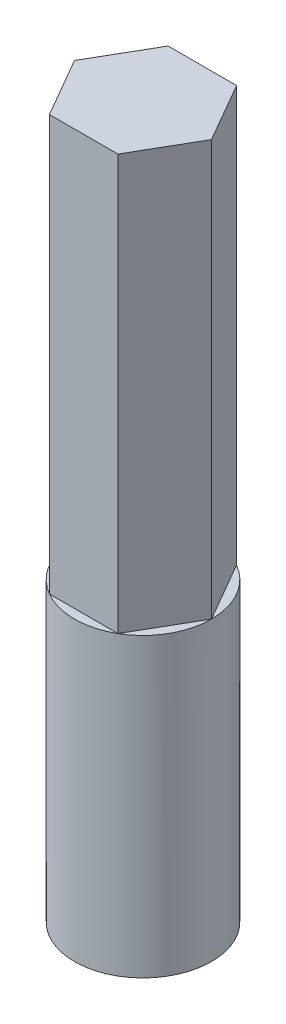
from build123d import *

# Parameters (mm, degrees)
BOSS_EXTRUDE1_DEPTH = 44.45
SKETCH4_R           = 7.332348419
BOSS_EXTRUDE2_DEPTH = 31.75


with BuildPart() as part:
    # Sketch3 → Boss-Extrude1 (new body)
    with BuildSketch(Plane(origin=(0, 0, 0), x_dir=(1, 0, 0), z_dir=(0, 1, 0))):
        Polygon((7.332348419, 0), (3.666174209, 6.35), (-3.666174209, 6.35), (-7.332348419, 0), (-3.666174209, -6.35), (3.666174209, -6.35), align=None)
    extrude(amount=BOSS_EXTRUDE1_DEPTH)

    # Sketch4 → Boss-Extrude2 (add)
    with BuildSketch(Plane.XZ):
        with Locations(Location((0, 0, 0), (0, 0, 60))):
            Circle(SKETCH4_R)
    extrude(amount=BOSS_EXTRUDE2_DEPTH)


solid = part.part
